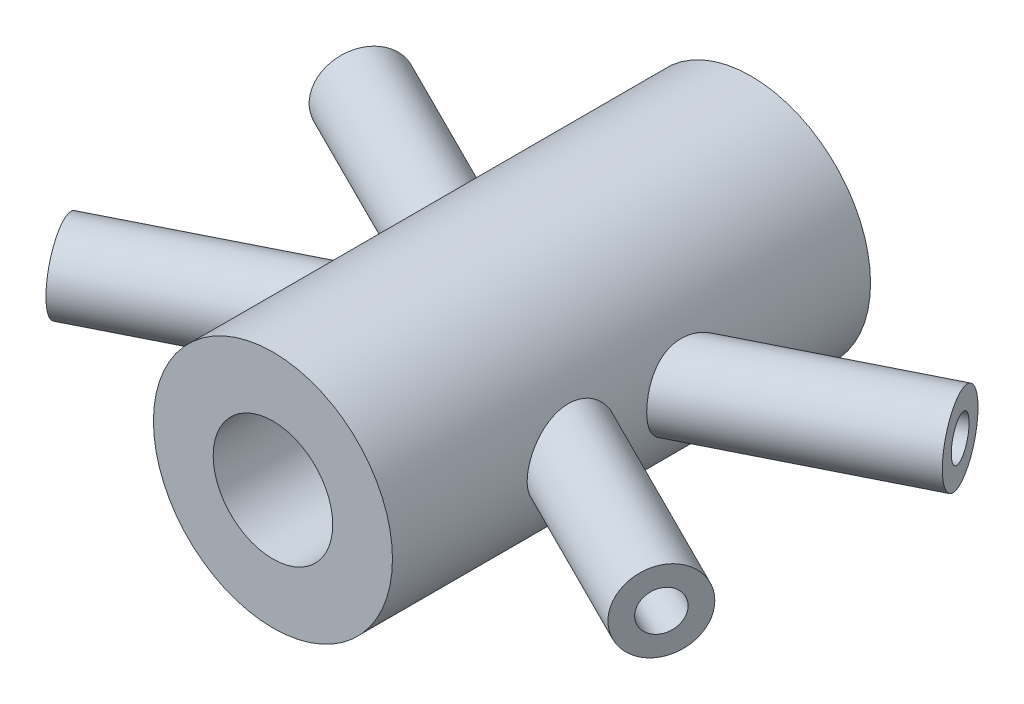
from build123d import *

# Parameters (mm, degrees)
CROQUIS1_R              = 60
SALIENTE_EXTRUIR1_DEPTH = 240
CROQUIS4_R              = 20
SALIENTE_EXTRUIR2_DEPTH = 335.410197
CROQUIS5_R              = 20
SALIENTE_EXTRUIR3_DEPTH = 335.410197
CROQUIS6_R              = 10
CORTAR_EXTRUIR2_DEPTH   = 335.410197
CROQUIS7_R              = 10
CORTAR_EXTRUIR3_DEPTH   = 335.410197
CROQUIS8_R              = 30
CORTAR_EXTRUIR4_DEPTH   = 304


with BuildPart() as part:
    # Croquis1 → Saliente-Extruir1 (new body)
    with BuildSketch(Plane.XY):
        Circle(CROQUIS1_R)
    extrude(amount=SALIENTE_EXTRUIR1_DEPTH)

    # Croquis4 → Saliente-Extruir2 (add)
    with BuildSketch(Plane(origin=(102, 0, -51), x_dir=(-0.44721359549995804, 0, -0.8944271909999159), z_dir=(0.8944271909999159, 0, -0.44721359549995804))):
        with Locations((-107.33126292, 0)):
            Circle(CROQUIS4_R)
    extrude(amount=-SALIENTE_EXTRUIR2_DEPTH)

    # Croquis5 → Saliente-Extruir3 (add)
    with BuildSketch(Plane(origin=(198, 0, 99), x_dir=(0.44721359549995826, 0, -0.8944271909999157), z_dir=(0.8944271909999157, 0, 0.44721359549995826))):
        with Locations((-107.33126292, 0)):
            Circle(CROQUIS5_R)
    extrude(amount=-SALIENTE_EXTRUIR3_DEPTH)

    # Croquis6 → Cortar-Extruir2 (cut)
    with BuildSketch(Plane(origin=(198, 0, 99), x_dir=(0.44721359549995826, 0, -0.8944271909999157), z_dir=(0.8944271909999157, 0, 0.44721359549995826))):
        with Locations((-107.33126292, 0)):
            Circle(CROQUIS6_R)
    extrude(amount=-CORTAR_EXTRUIR2_DEPTH, mode=Mode.SUBTRACT)

    # Croquis7 → Cortar-Extruir3 (cut)
    with BuildSketch(Plane(origin=(102, 0, -51), x_dir=(-0.44721359549995804, 0, -0.8944271909999159), z_dir=(0.8944271909999159, 0, -0.44721359549995804))):
        with Locations((-107.33126292, 0)):
            Circle(CROQUIS7_R)
    extrude(amount=-CORTAR_EXTRUIR3_DEPTH, mode=Mode.SUBTRACT)

    # Croquis8 → Cortar-Extruir4 (cut)
    with BuildSketch(Plane(origin=(0, 0, 0), x_dir=(-1, 0, 0), z_dir=(0, 0, -1))):
        Circle(CROQUIS8_R)
    extrude(amount=-CORTAR_EXTRUIR4_DEPTH, mode=Mode.SUBTRACT)


solid = part.part
